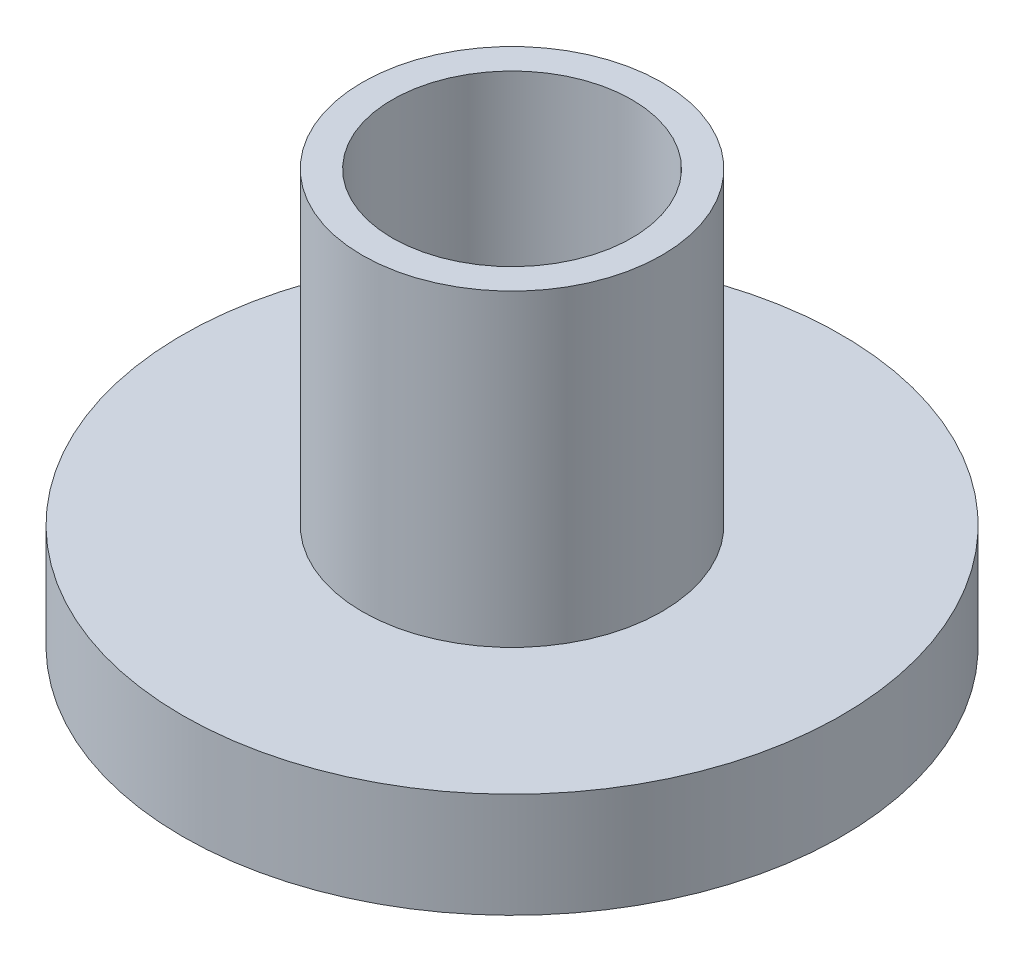
from build123d import *

# Parameters (mm, degrees)
SKETCH_1_R          = 5
EXTRUDE_1_DEPTH     = 1.2
SKETCH_2_R          = 11
EXTRUDE_2_DEPTH     = 3.5
SKETCH_3_R          = 5
EXTRUDE_3_DEPTH     = 10.3
SKETCH_4_R          = 4
CUT_EXTRUDE_1_DEPTH = 22.610182785


with BuildPart() as part:
    # 草图1 → 凸台-拉伸1 (new body)
    with BuildSketch(Plane(origin=(0, 0, 0), x_dir=(1, 0, 0), z_dir=(0, 1, 0))):
        with Locations(Location((0, 0, 0), (0, 0, 270))):
            Circle(SKETCH_1_R)
    extrude(amount=EXTRUDE_1_DEPTH)

    # 草图2 → 凸台-拉伸2 (add)
    with BuildSketch(Plane(origin=(0, 1.2, 0), x_dir=(1, 0, 0), z_dir=(0, 1, 0))):
        with Locations(Location((0, 0, 0), (0, 0, 270))):
            Circle(SKETCH_2_R)
    extrude(amount=EXTRUDE_2_DEPTH)

    # 草图3 → 凸台-拉伸3 (add)
    with BuildSketch(Plane(origin=(0, 4.7, 0), x_dir=(1, 0, 0), z_dir=(0, 1, 0))):
        with Locations(Location((0, 0, 0), (0, 0, 270))):
            Circle(SKETCH_3_R)
    extrude(amount=EXTRUDE_3_DEPTH)

    # 草图4 → 切除-拉伸1 (cut, through all)
    with BuildSketch(Plane(origin=(0, 15, 0), x_dir=(1, 0, 0), z_dir=(0, 1, 0))):
        with Locations(Location((0, 0, 0), (0, 0, 270))):
            Circle(SKETCH_4_R)
    extrude(amount=-CUT_EXTRUDE_1_DEPTH, mode=Mode.SUBTRACT)


solid = part.part
